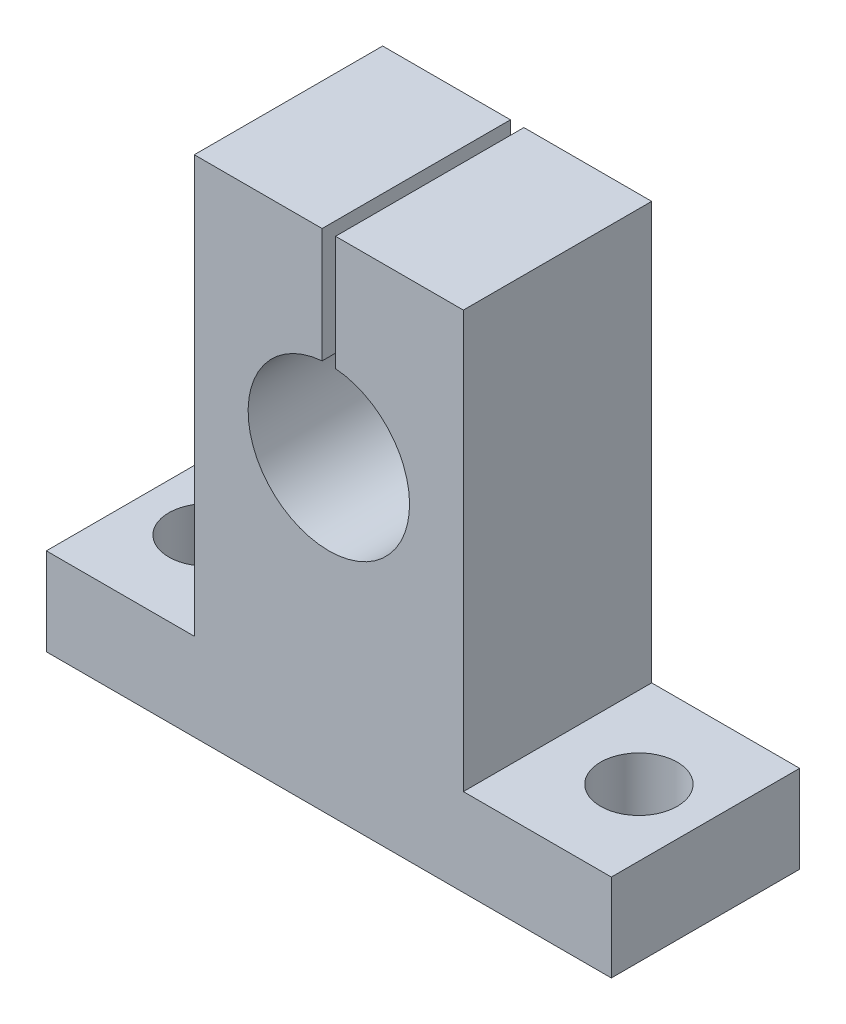
from build123d import *

# Parameters (mm, degrees)
Y_KSEKLIK_EKSTR_ZYON2_DEPTH       = 14
KES_EKSTR_ZYON1_REACH             = 47.202
IZIM2_R                           = 2.85
KES_EKSTR_ZYON1_DIRECTION_2_DEPTH = 46.202322949


with BuildPart() as part:
    # Çizim1 → Yükseklik-Ekstrüzyon2 (new body)
    with BuildSketch(Plane.XY):
        with BuildLine():
            Line((21, -23), (-21, -23))
            Line((-21, -23), (-21, -16.5))
            Line((-21, -16.5), (-10, -16.5))
            Line((-10, -16.5), (-10, 14.5))
            Line((-10, 14.5), (-0.5, 14.5))
            Line((-0.5, 14.5), (-0.5, 5.979130372))
            ThreePointArc((-0.5, 5.979130372), (0, -6), (0.5, 5.979130372))
            Line((0.5, 5.979130372), (0.5, 14.5))
            Line((0.5, 14.5), (10, 14.5))
            Line((10, 14.5), (10, -16.5))
            Line((10, -16.5), (21, -16.5))
            Line((21, -16.5), (21, -23))
        make_face()
    extrude(amount=Y_KSEKLIK_EKSTR_ZYON2_DEPTH)

    # Çizim2 → Kes-Ekstrüzyon1 (cut, up to next)
    with BuildSketch(Plane.XZ.offset(23), mode=Mode.PRIVATE) as kes_ekstr_zyon1_sk1:
        with Locations(Location((-16.05, 7, 0), (0, 0, 90))):
            Circle(IZIM2_R)
    kes_ekstr_zyon1_tool1 = extrude(kes_ekstr_zyon1_sk1.sketch, amount=-KES_EKSTR_ZYON1_REACH, mode=Mode.PRIVATE) & part.part
    # Çizim2 → Kes-Ekstrüzyon1 (cut, up to next)
    with BuildSketch(Plane.XZ.offset(23), mode=Mode.PRIVATE) as kes_ekstr_zyon1_sk2:
        with Locations(Location((16.05, 7, 0), (0, 0, 90))):
            Circle(IZIM2_R)
    kes_ekstr_zyon1_tool2 = extrude(kes_ekstr_zyon1_sk2.sketch, amount=-KES_EKSTR_ZYON1_REACH, mode=Mode.PRIVATE) & part.part
    add(kes_ekstr_zyon1_tool1.solids().sort_by_distance((-16.05, -23, 7))[0], mode=Mode.SUBTRACT)
    add(kes_ekstr_zyon1_tool2.solids().sort_by_distance((16.05, -23, 7))[0], mode=Mode.SUBTRACT)

    # Çizim2 → Kes-Ekstrüzyon1 direction 2 (cut)
    with BuildSketch(Plane.XZ.offset(23)):
        with Locations(Location((-16.05, 7, 0), (0, 0, 90))):
            Circle(IZIM2_R)
        with Locations(Location((16.05, 7, 0), (0, 0, 90))):
            Circle(IZIM2_R)
    extrude(amount=KES_EKSTR_ZYON1_DIRECTION_2_DEPTH, mode=Mode.SUBTRACT)


solid = part.part
